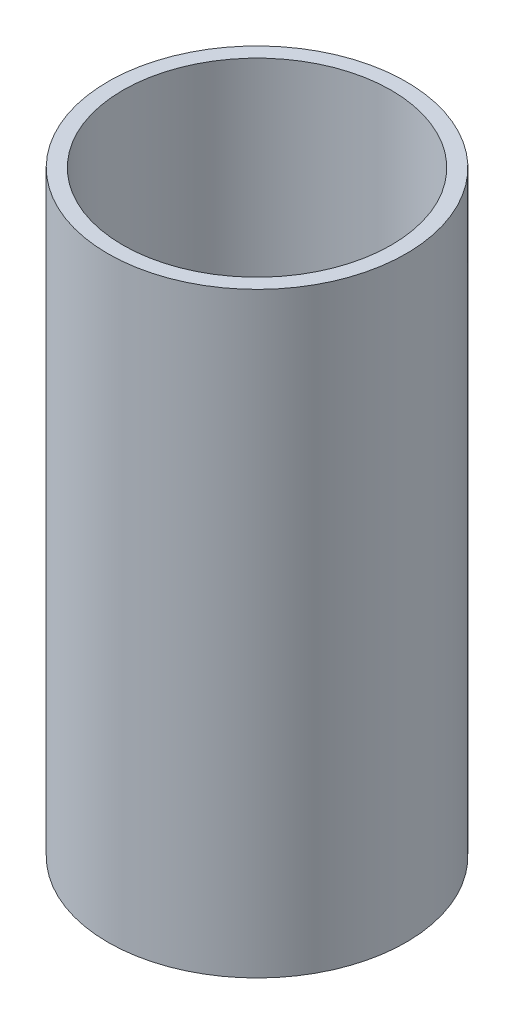
from build123d import *

# Parameters (mm, degrees)
SKETCH1_R           = 50
SKETCH1_R_2         = 45
BOSS_EXTRUDE1_DEPTH = 200


with BuildPart() as part:
    # Sketch1 → Boss-Extrude1 (new body)
    with BuildSketch(Plane(origin=(0, 0, 0), x_dir=(1, 0, 0), z_dir=(0, 1, 0))):
        with Locations(Location((0, 0, 0), (0, 0, 270))):
            Circle(SKETCH1_R)
        with Locations(Location((0, 0, 0), (0, 0, 270))):
            Circle(SKETCH1_R_2, mode=Mode.SUBTRACT)
    extrude(amount=BOSS_EXTRUDE1_DEPTH)


solid = part.part
